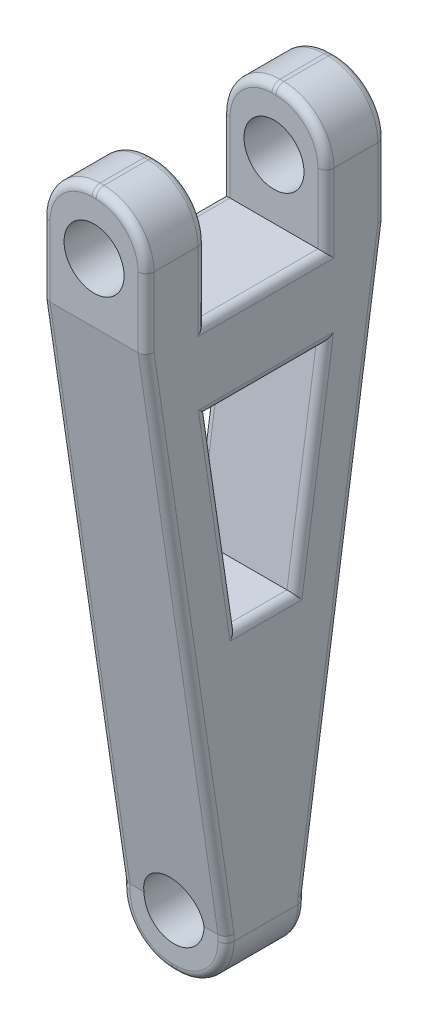
from build123d import *

# Parameters (mm, degrees)
BOSS_EXTRUDE1_DEPTH      = 25
BOSS_EXTRUDE1_DEPTH_BACK = 1
FILLET1_R                = 12.5
CUT_EXTRUDE3_DEPTH       = 132.655011329
CUT_EXTRUDE3_DEPTH_BACK  = 132.655011329
SKETCH3_R                = 7.5
FILLET4_R                = 2


with BuildPart() as part:
    # Sketch1 → Boss-Extrude1 (new, two sides: drawn at the far end of the back side and taken through both)
    with BuildSketch(Plane.YZ.offset(-BOSS_EXTRUDE1_DEPTH_BACK)):
        Polygon((-54.26996378, -10), (-54.26996378, 10), (-40.299013823, 10), (95.73003622, 30), (125.73003622, 30), (125.73003622, 15), (95.73003622, 15), (95.73003622, -15), (125.73003622, -15), (125.73003622, -30), (95.73003622, -30), (-40.299013823, -10), align=None)
        Polygon((25.73003622, -7.247706801), (25.73003622, 7.247706801), (75.73003622, 14.599077701), (75.73003622, -14.599077701), align=None, mode=Mode.SUBTRACT)
    extrude(amount=BOSS_EXTRUDE1_DEPTH + BOSS_EXTRUDE1_DEPTH_BACK)

    # Fillet1
    fillet1_edges = [part.edges().sort_by_distance(p)[0] for p in [
        (25, 125.73003622, -22.5),
        (25, -54.26996378, 0),
        (-1, 125.73003622, -22.5),
        (-1, -54.26996378, 0),
        (25, 125.73003622, 22.5),
        (-1, 125.73003622, 22.5),
    ]]
    fillet(fillet1_edges, radius=FILLET1_R)

    # Sketch3 → Cut-Extrude3 (cut, two sides: drawn at the far end of the back side and taken through both)
    with BuildSketch(Plane(origin=(0, 0, 0), x_dir=(0, 1, 0), z_dir=(0, 0, 1)).offset(-CUT_EXTRUDE3_DEPTH_BACK)):
        with Locations(Location((-40.299013823, -12, 0), (0, 0, 270))):
            Circle(SKETCH3_R)
        with Locations(Location((110.619547971, -12, 0), (0, 0, 270))):
            Circle(SKETCH3_R)
    extrude(amount=CUT_EXTRUDE3_DEPTH + CUT_EXTRUDE3_DEPTH_BACK, mode=Mode.SUBTRACT)

    # Fillet4
    fillet4_edges = [part.edges().sort_by_distance(p)[0] for p in [
        (12, 125.73003622, 15),
        (21.338834765, 122.068870985, 15),
        (2.661165235, 122.068870985, 15),
        (12, 125.73003622, 30),
        (21.338834765, 122.068870985, 30),
        (2.661165235, 122.068870985, 30),
        (25, 104.48003622, -30),
        (25, 27.715511199, -20),
        (25, 75.73003622, 0),
        (25, 50.73003622, 10.923392251),
        (25, 25.73003622, 0),
        (25, 50.73003622, -10.923392251),
        (25, 27.715511199, 20),
        (-1, 104.48003622, -30),
        (-1, 27.715511199, -20),
        (25, 104.48003622, 30),
        (-1, 50.73003622, -10.923392251),
        (-1, 95.73003622, 0),
        (-1, 27.715511199, 20),
        (-1, 104.48003622, 30),
        (-1, 25.73003622, 0),
        (-1, 50.73003622, 10.923392251),
        (-1, 75.73003622, 0),
        (-1, 104.48003622, 15),
        (-1, 104.48003622, -15),
        (-1, -41.034488801, -10),
        (-1, -41.034488801, 10),
        (12, -54.26996378, 10),
        (25, -41.034488801, 10),
        (21.338834765, -50.608798545, 10),
        (2.661165235, -50.608798545, 10),
        (12, -54.26996378, -10),
        (25, 95.73003622, 0),
        (25, -41.034488801, -10),
        (21.338834765, -50.608798545, -10),
        (2.661165235, -50.608798545, -10),
        (25, 104.48003622, 15),
        (25, 104.48003622, -15),
        (12, 125.73003622, -30),
        (12, 125.73003622, -15),
        (21.338834765, 122.068870985, -15),
        (2.661165235, 122.068870985, -15),
        (21.338834765, 122.068870985, -30),
        (2.661165235, 122.068870985, -30),
    ]]
    fillet(fillet4_edges, radius=FILLET4_R)


solid = part.part
